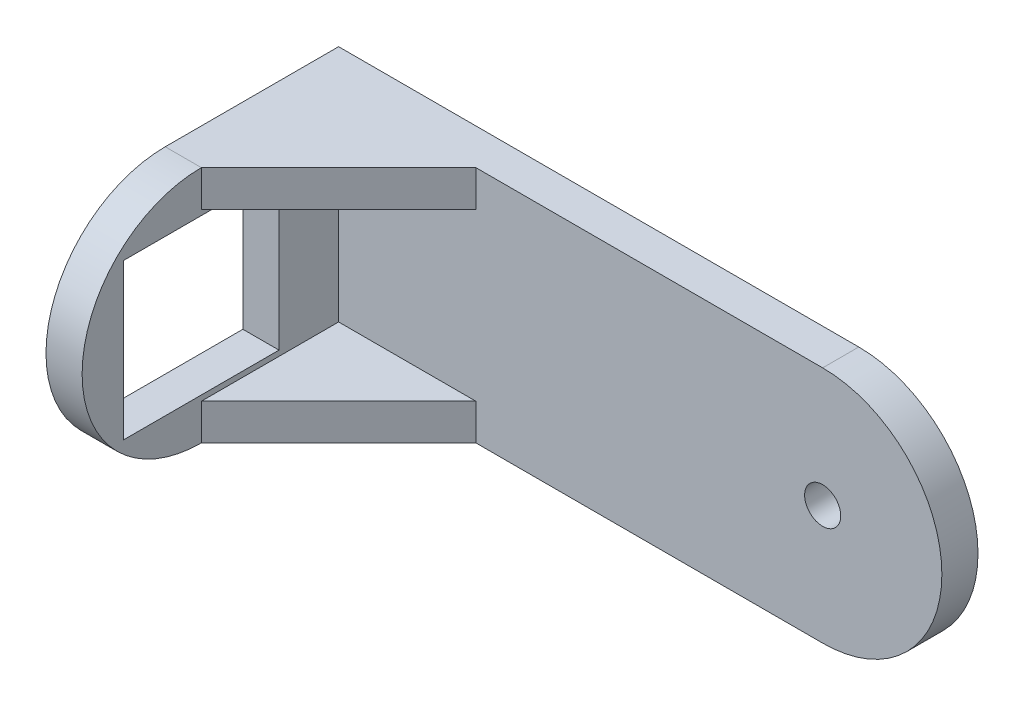
from build123d import *

# Parameters (mm, degrees)
SKETCH1_R           = 5
BOSS_EXTRUDE1_DEPTH = 10
SKETCH3_W           = 43
SKETCH3_H           = 43
BOSS_EXTRUDE3_DEPTH = 10
BOSS_EXTRUDE4_DEPTH = 10


with BuildPart() as part:
    # Sketch1 → Boss-Extrude1 (new body)
    with BuildSketch(Plane.XY):
        with BuildLine():
            Line((0, 33), (-144, 33))
            Line((-144, 33), (-144, -33))
            Line((-144, -33), (0, -33))
            ThreePointArc((0, -33), (33, 0), (0, 33))
        make_face()
        Circle(SKETCH1_R, mode=Mode.SUBTRACT)
    extrude(amount=BOSS_EXTRUDE1_DEPTH)

    # Sketch3 → Boss-Extrude3 (add)
    with BuildSketch(Plane.ZY.offset(144)):
        with BuildLine():
            Line((48, 33), (10, 33))
            Line((10, 33), (10, -33))
            Line((10, -33), (48, -33))
            ThreePointArc((48, -33), (81, 0), (48, 33))
        make_face()
        with Locations((48, 0)):
            Rectangle(SKETCH3_W, SKETCH3_H, mode=Mode.SUBTRACT)
    extrude(amount=-BOSS_EXTRUDE3_DEPTH)

    # Sketch4 → Boss-Extrude4 (add)
    with BuildSketch(Plane(origin=(0, 33, 0), x_dir=(1, 0, 0), z_dir=(0, 1, 0))):
        Polygon((-134, -48), (-96, -10), (-134, -10), align=None)
    boss_extrude4 = extrude(amount=-BOSS_EXTRUDE4_DEPTH)

    # Mirror1: Boss-Extrude4 across plane
    add(boss_extrude4.mirror(Plane.ZX))


solid = part.part
